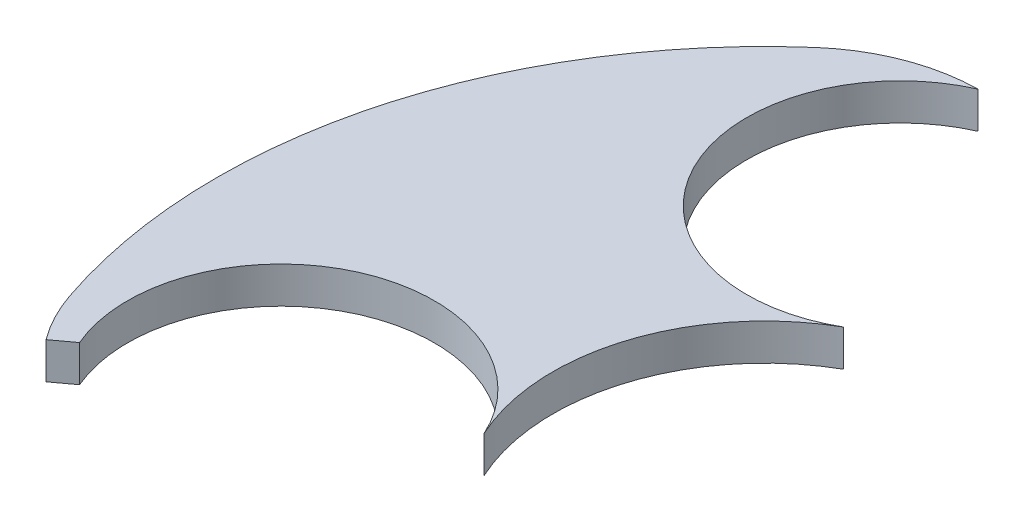
from build123d import *

# Parameters (mm, degrees)
BOSS_EXTRU_1_DEPTH = 5


with BuildPart() as part:
    # Esquisse1 → Boss.-Extru.1 (new body)
    with BuildSketch(Plane(origin=(0, 0, 0), x_dir=(1, 0, 0), z_dir=(0, 1, 0))):
        with BuildLine():
            ThreePointArc((-88.017976153, -38.015428103), (-86.50201361, -41.562295618), (-84.458479206, -44.833744647))
            Line((-84.458479206, -44.833744647), (-81.815842439, -42.884303709))
            ThreePointArc((-81.815842439, -42.884303709), (-70.968463998, -15.424955777), (-43.384090899, -25.950342641))
            ThreePointArc((-43.384090899, -25.950342641), (-44.585088361, -5.046948778), (-31.398618719, 11.21685423))
            ThreePointArc((-31.398618719, 11.21685423), (-60.563222829, 19.936478121), (-50.379796194, 48.622777911))
            ThreePointArc((-50.379796194, 48.622777911), (-58.97592755, 46.948798531), (-66.46729281, 42.41281707))
            ThreePointArc((-66.46729281, 42.41281707), (-89.429119341, 5.46405326), (-88.017976153, -38.015428103))
        make_face()
    extrude(amount=BOSS_EXTRU_1_DEPTH)


solid = part.part
